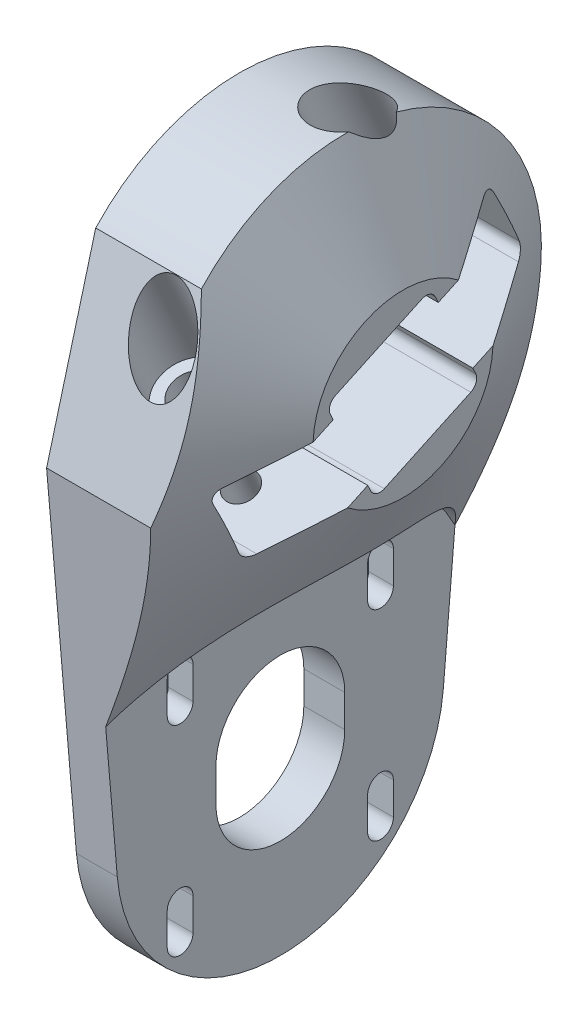
from build123d import *

# Parameters (mm, degrees)
BOSS_EXTRUDE1_DEPTH = 6.35
CUT_EXTRUDE18_DEPTH = 10
SKETCH20_R          = 57.15
BOSS_EXTRUDE5_DEPTH = 19.05
CUT_EXTRUDE14_DEPTH = 106.568863781
SKETCH22_R          = 3.175
CUT_EXTRUDE15_DEPTH = 112.672649781
SKETCH24_R          = 5
CUT_EXTRUDE16_DEPTH = 117.574618566
SKETCH25_R          = 2.38125
CUT_EXTRUDE17_DEPTH = 10
CHAMFER2_SIZE       = 2.5
FILLET1_R           = 1.5875
SKETCH28_R          = 30.48
CUT_EXTRUDE19_DEPTH = 105.22344993
CUT_EXTRUDE20_DEPTH = 100.947550226
CUT_EXTRUDE21_DEPTH = 94.849309593


with BuildPart() as part:
    # Sketch1 → Boss-Extrude1 (new body)
    with BuildSketch(Plane(origin=(0, 0, 0), x_dir=(0, 0, -1), z_dir=(1, 0, 0))):
        with BuildLine():
            Line((-30.369265969, -2.595782062), (-25.307721641, -61.813151718))
            ThreePointArc((-25.307721641, -61.813151718), (0, -85.05), (25.307721641, -61.813151718))
            Line((25.307721641, -61.813151718), (30.369265969, -2.595782062))
            ThreePointArc((30.369265969, -2.595782062), (0, 30.48), (-30.369265969, -2.595782062))
        make_face()
        Polygon((4.353205728, 11.960334439), (-11.960334439, 4.353205728), (-4.353205728, -11.960334439), (11.960334439, -4.353205728), align=None, mode=Mode.SUBTRACT)
    extrude(amount=BOSS_EXTRUDE1_DEPTH)

    # Sketch19 → Cut-Extrude18 (cut)
    with BuildSketch(Plane(origin=(6.35, 0, 0), x_dir=(0, 0, -1), z_dir=(1, 0, 0))):
        with BuildLine():
            Line((13.556349186, -39.093650814), (13.556349186, -44.093650814))
            ThreePointArc((13.556349186, -44.093650814), (15.556349186, -46.093650814), (17.556349186, -44.093650814))
            Line((17.556349186, -44.093650814), (17.556349186, -39.093650806))
            ThreePointArc((17.556349186, -39.093650806), (15.556349182, -37.093650814), (13.556349186, -39.093650814))
        make_face()
        with BuildLine():
            Line((-10, -54.65), (-10, -59.65))
            ThreePointArc((-10, -59.65), (0, -69.65), (10, -59.65))
            Line((10, -59.65), (10, -54.65))
            ThreePointArc((10, -54.65), (0, -44.65), (-10, -54.65))
        make_face()
        with BuildLine():
            Line((17.556349186, -75.206349194), (17.556349186, -70.206349186))
            ThreePointArc((17.556349186, -70.206349186), (15.556349186, -68.206349186), (13.556349186, -70.206349186))
            Line((13.556349186, -70.206349186), (13.556349186, -75.206349186))
            ThreePointArc((13.556349186, -75.206349186), (15.556349182, -77.206349186), (17.556349186, -75.206349194))
        make_face()
        with BuildLine():
            Line((-17.556349186, -39.093650806), (-17.556349186, -44.093650814))
            ThreePointArc((-17.556349186, -44.093650814), (-15.556349186, -46.093650814), (-13.556349186, -44.093650814))
            Line((-13.556349186, -44.093650814), (-13.556349186, -39.093650814))
            ThreePointArc((-13.556349186, -39.093650814), (-15.556349182, -37.093650814), (-17.556349186, -39.093650806))
        make_face()
        with BuildLine():
            Line((-13.556349186, -75.206349186), (-13.556349186, -70.206349186))
            ThreePointArc((-13.556349186, -70.206349186), (-15.556349186, -68.206349186), (-17.556349186, -70.206349186))
            Line((-17.556349186, -70.206349186), (-17.556349186, -75.206349194))
            ThreePointArc((-17.556349186, -75.206349194), (-15.556349182, -77.206349186), (-13.556349186, -75.206349186))
        make_face()
    extrude(amount=-CUT_EXTRUDE18_DEPTH, mode=Mode.SUBTRACT)

    # Sketch20 → Boss-Extrude5 (add)
    with BuildSketch(Plane(origin=(6.35, 0, 0), x_dir=(0, 0, -1), z_dir=(1, 0, 0))):
        with Locations(Location((0, 0, 0), (0, 0, 242.654471511))):
            Circle(SKETCH20_R)
    extrude(amount=BOSS_EXTRUDE5_DEPTH)

    # Sketch21 → Cut-Extrude14 (cut, through all)
    with BuildSketch(Plane.ZY):
        Polygon((-19.067760927, 15.897892729), (-24.435012851, 4.387783834), (-10.840396045, -1.951490092), (-5.473144121, 9.558618803), align=None)
        Polygon((-11.960334439, -4.353205728), (-4.353205728, 11.960334439), (11.960334439, 4.353205728), (4.353205728, -11.960334439), align=None)
        Polygon((10.840396045, 1.951490092), (5.473144121, -9.558618803), (19.067760927, -15.897892729), (24.435012851, -4.387783834), align=None)
    extrude(amount=-CUT_EXTRUDE14_DEPTH, mode=Mode.SUBTRACT)

    # Sketch22 → Cut-Extrude15 (cut, through all)
    with BuildSketch(Plane(origin=(0, 5.755054448, 2.683625962), x_dir=(-1, 0, 0), z_dir=(0, -0.9063077870366495, -0.4226182617407005))):
        with Locations(Location((-12.5, -16.5, 0), (0, 0, 90))):
            Circle(SKETCH22_R)
    cut_extrude15 = extrude(amount=-CUT_EXTRUDE15_DEPTH, mode=Mode.SUBTRACT)

    # Sketch24 → Cut-Extrude16 (cut, through all)
    with BuildSketch(Plane(origin=(0, 10.359098006, 4.830526732), x_dir=(-1, 0, 0), z_dir=(0, -0.9063077870366495, -0.4226182617407005))):
        with Locations(Location((-12.5, -16.5, 0), (0, 0, 90))):
            Circle(SKETCH24_R)
    cut_extrude16 = extrude(amount=-CUT_EXTRUDE16_DEPTH, mode=Mode.SUBTRACT)

    # Sketch25 → Cut-Extrude17 (cut)
    with BuildSketch(Plane(origin=(0, -5.755054448, -2.683625962), x_dir=(1, 0, 0), z_dir=(0, 0.9063077870366495, 0.4226182617407006))):
        with Locations(Location((12.5, -16.5, 0), (0, 0, 270))):
            Circle(SKETCH25_R)
    cut_extrude17 = extrude(amount=-CUT_EXTRUDE17_DEPTH, mode=Mode.SUBTRACT)

    # Mirror1: Cut-Extrude15, Cut-Extrude16, Cut-Extrude17 across plane
    add(cut_extrude15.mirror(Plane(origin=(0, 0, 0), x_dir=(1, 0, 0), z_dir=(0, 0.42261826174070105, -0.9063077870366493))), mode=Mode.SUBTRACT)
    add(cut_extrude16.mirror(Plane(origin=(0, 0, 0), x_dir=(1, 0, 0), z_dir=(0, 0.42261826174070105, -0.9063077870366493))), mode=Mode.SUBTRACT)
    add(cut_extrude17.mirror(Plane(origin=(0, 0, 0), x_dir=(1, 0, 0), z_dir=(0, 0.42261826174070105, -0.9063077870366493))), mode=Mode.SUBTRACT)


with BuildPart() as body_2:
    # Mirror2: mirrored copy
    add(part.part.mirror(Plane(origin=(0, 0, 0), x_dir=(0, 0, 1), z_dir=(1, 0, 0))))


with BuildPart() as part_1:
    add(part.part)

    # Chamfer2
    chamfer2_edges = [part_1.edges().sort_by_distance(p)[0] for p in [
        (0, -41.593650814, 13.556349186),
        (0, -37.093650814, 15.556349182),
        (0, -41.59365081, 17.556349186),
        (0, -46.093650814, 15.556349186),
        (0, -41.59365081, -17.556349186),
        (0, -37.093650814, -15.556349182),
        (0, -41.593650814, -13.556349186),
        (0, -46.093650814, -15.556349186),
    ]]
    chamfer(chamfer2_edges, length=CHAMFER2_SIZE)

    # Fillet1
    fillet1_edges = [part_1.edges().sort_by_distance(p)[0] for p in [
        (12.7, 4.387783834, -24.435012851),
        (12.7, 15.897892729, -19.067760927),
        (12.7, -4.387783834, 24.435012851),
        (12.7, -15.897892729, 19.067760927),
        (12.7, 11.960334439, -4.353205728),
        (12.7, 4.353205728, 11.960334439),
        (12.7, -11.960334439, 4.353205728),
        (12.7, -4.353205728, -11.960334439),
    ]]
    fillet(fillet1_edges, radius=FILLET1_R)

    # Sketch28 → Cut-Extrude19 (cut, through all)
    with BuildSketch(Plane(origin=(6.35, 0, 0), x_dir=(0, 0, -1), z_dir=(1, 0, 0))):
        with Locations((0, -54.65)):
            Circle(SKETCH28_R)
    extrude(amount=CUT_EXTRUDE19_DEPTH, mode=Mode.SUBTRACT)

    # Sketch31 → Cut-Revolve1 (revolve, cut)
    with BuildSketch(Plane(origin=(0, 0, 0), x_dir=(1, 0, 0), z_dir=(0, 1, 0)), mode=Mode.PRIVATE) as cut_revolve1_sk:
        Polygon((6.35, -59.952108656), (25.4, -59.952108656), (25.4, -13.97), (6.35, -48.91940088), align=None)
    revolve(cut_revolve1_sk.sketch.rotate(Axis((25.4, 0, 0), (-1, 0, 0)), 2.035690426), axis=Axis((25.4, 0, 0), (-1, 0, 0)), mode=Mode.SUBTRACT)

    # Sketch32 → Cut-Extrude20 (cut, through all)
    with BuildSketch(Plane.ZY.offset(-6.35)):
        with BuildLine():
            Line((30.369265969, -2.595782062), (27.110634253, -40.720035521))
            ThreePointArc((27.110634253, -40.720035521), (0, 48.91940088), (-27.110634253, -40.720035521))
            Line((-27.110634253, -40.720035521), (-30.369265969, -2.595782062))
            ThreePointArc((-30.369265969, -2.595782062), (0, 30.48), (30.369265969, -2.595782062))
        make_face()
    extrude(amount=-CUT_EXTRUDE20_DEPTH, mode=Mode.SUBTRACT)

    # Sketch33 → Cut-Extrude21 (cut, through all)
    with BuildSketch(Plane.ZY):
        with BuildLine():
            Line((29.933954685, -7.688691966), (30.369265969, -2.595782062))
            ThreePointArc((30.369265969, -2.595782062), (28.813559126, 9.940282213), (22.308746363, 20.76897291))
            Line((22.308746363, 20.76897291), (29.933954685, -7.688691966))
        make_face()
    extrude(amount=-CUT_EXTRUDE21_DEPTH, mode=Mode.SUBTRACT)


solid = part_1.part
